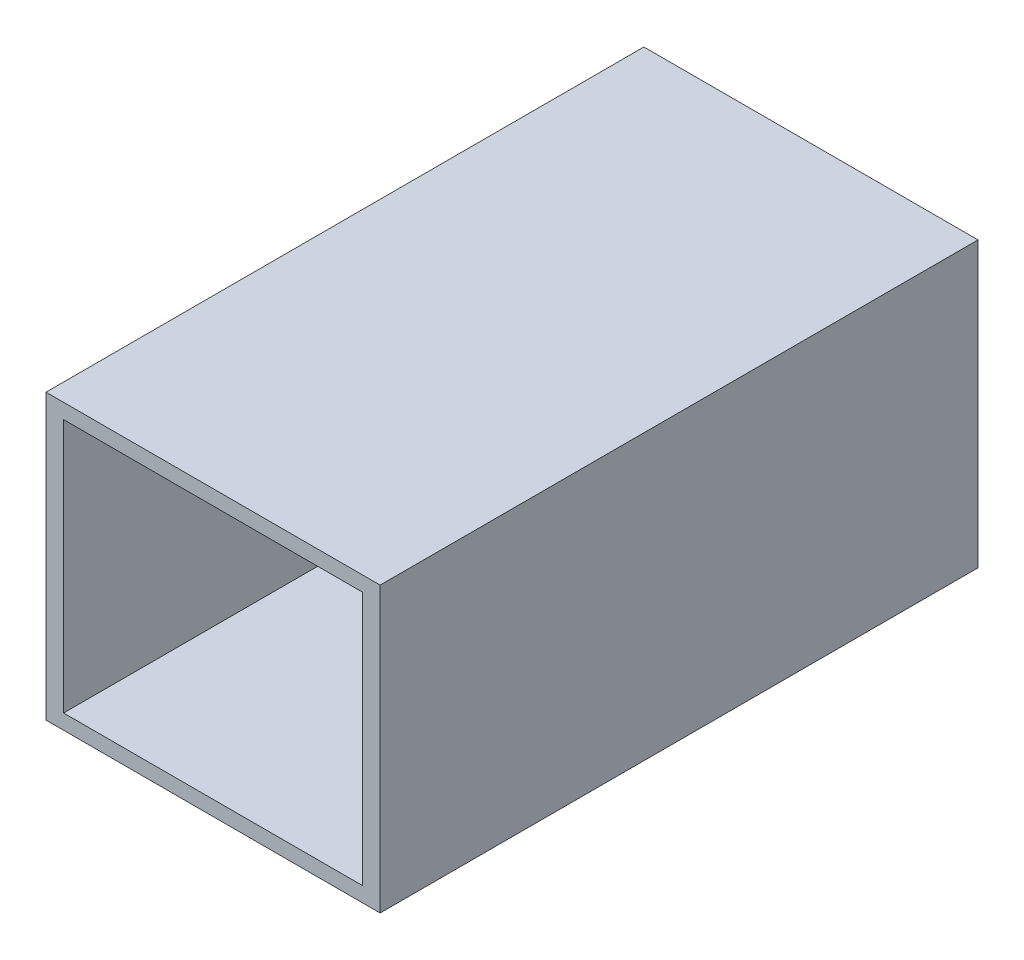
from build123d import *

# Parameters (mm, degrees)
SKETCH1_W           = 283.882352942
SKETCH1_H           = 241.3
SKETCH1_W_2         = 254
SKETCH1_H_2         = 215.9
BOSS_EXTRUDE1_DEPTH = 508


with BuildPart() as part:
    # Sketch1 → Boss-Extrude1 (new body)
    with BuildSketch(Plane.XY):
        Rectangle(SKETCH1_W, SKETCH1_H)
        Rectangle(SKETCH1_W_2, SKETCH1_H_2, mode=Mode.SUBTRACT)
    extrude(amount=BOSS_EXTRUDE1_DEPTH)


solid = part.part
